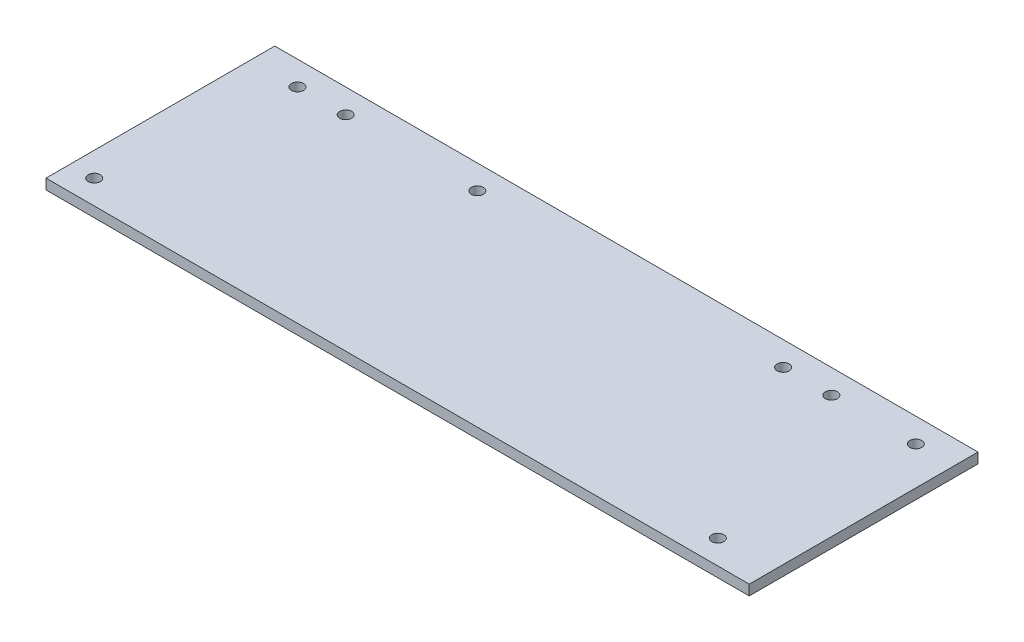
from build123d import *

# Parameters (mm, degrees)
SKETCH1_R           = 3.175
SKETCH1_W           = 40.386
SKETCH1_H           = 95.0722
SKETCH1_W_2         = 5.4102
SKETCH1_H_2         = 12.7
BOSS_EXTRUDE1_DEPTH = 5.4102


with BuildPart() as part:
    # Sketch1 → Boss-Extrude1 (new body)
    # profile 1 of 4: a face of its own
    with BuildSketch(Plane(origin=(0, 0, 0), x_dir=(1, 0, 0), z_dir=(0, 1, 0))):
        Polygon((-165.481, 47.5361), (-165.481, -47.5361), (86.5759, -47.5361), (91.9861, -47.5361), (114.8334, -47.5361), (164.465, -47.5361), (164.465, -42.1259), (164.465, 47.5361), (62.5475, 47.5361), (-73.787, 47.5361), align=None)
        with Locations(Location((-155.829, 34.8361, 0), (0, 0, 270))):
            Circle(SKETCH1_R, mode=Mode.SUBTRACT)
        with Locations(Location((-86.487, 34.8361, 0), (0, 0, 270))):
            Circle(SKETCH1_R, mode=Mode.SUBTRACT)
        with Locations(Location((74.549, 34.8361, 0), (0, 0, 270))):
            Circle(SKETCH1_R, mode=Mode.SUBTRACT)
        with Locations(Location((99.949, 34.8361, 0), (0, 0, 270))):
            Circle(SKETCH1_R, mode=Mode.SUBTRACT)
        with Locations(Location((144.399, 34.8361, 0), (0, 0, 270))):
            Circle(SKETCH1_R, mode=Mode.SUBTRACT)
    # profile 2 of 4: a face of its own
    with BuildSketch(Plane(origin=(0, 0, 0), x_dir=(1, 0, 0), z_dir=(0, 1, 0))):
        with Locations((-185.674, 0)):
            Rectangle(SKETCH1_W, SKETCH1_H)
        with Locations(Location((-181.229, 34.8361, 0), (0, 0, 270))):
            Circle(SKETCH1_R, mode=Mode.SUBTRACT)
    # profile 3 of 4: a face of its own
    with BuildSketch(Plane(origin=(0, 0, 0), x_dir=(1, 0, 0), z_dir=(0, 1, 0))):
        Polygon((86.5759, -47.5361), (-165.481, -47.5361), (-205.867, -47.5361), (-205.867, -72.9361), (164.465, -72.9361), (164.465, -47.5361), (114.8334, -47.5361), (91.9861, -47.5361), (91.9861, -60.2361), (86.5759, -60.2361), align=None)
        with Locations(Location((-193.167, -60.2361, 0), (0, 0, 270))):
            Circle(SKETCH1_R, mode=Mode.SUBTRACT)
        with Locations(Location((135.255, -60.2361, 0), (0, 0, 270))):
            Circle(SKETCH1_R, mode=Mode.SUBTRACT)
    # profile 4 of 4: a face of its own
    with BuildSketch(Plane(origin=(0, 0, 0), x_dir=(1, 0, 0), z_dir=(0, 1, 0))):
        with Locations((89.281, -53.8861)):
            Rectangle(SKETCH1_W_2, SKETCH1_H_2)
    extrude(amount=BOSS_EXTRUDE1_DEPTH)


solid = part.part
